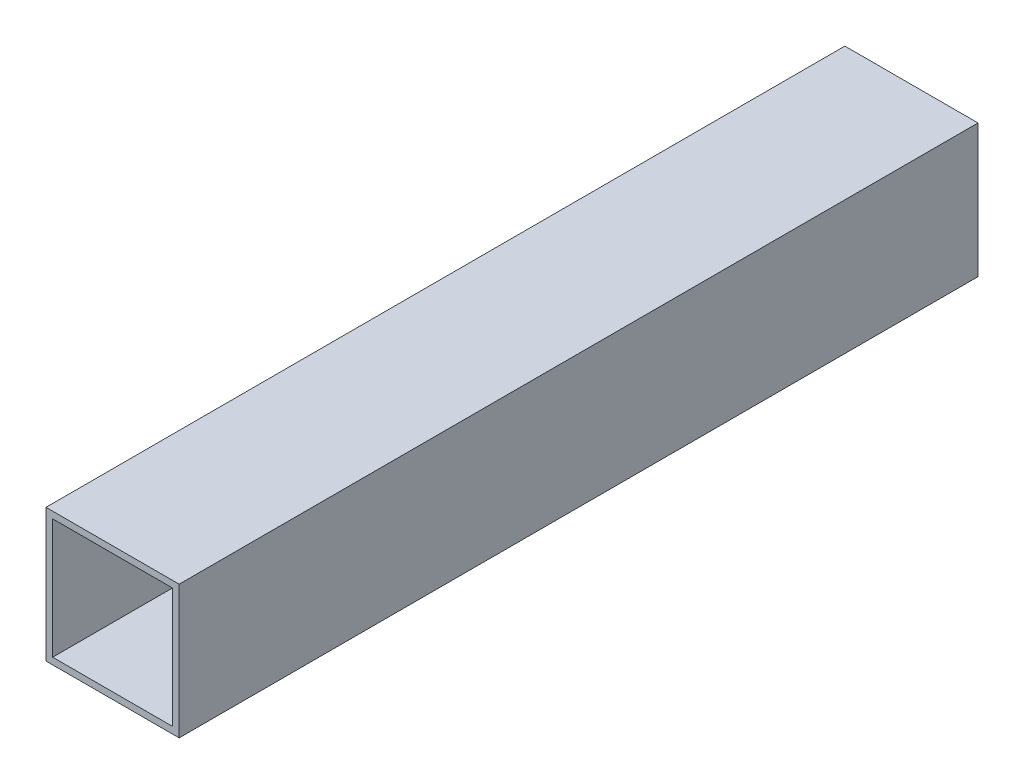
from build123d import *

# Parameters (mm, degrees)
SKETCH_1_W      = 10
SKETCH_1_H      = 10
SKETCH_1_W_2    = 9
SKETCH_1_H_2    = 9
EXTRUDE_1_DEPTH = 60


with BuildPart() as part:
    # 草图1 → 凸台-拉伸1 (new body)
    with BuildSketch(Plane.XY):
        with Locations((5, 5)):
            Rectangle(SKETCH_1_W, SKETCH_1_H)
        with Locations((5, 5)):
            Rectangle(SKETCH_1_W_2, SKETCH_1_H_2, mode=Mode.SUBTRACT)
    extrude(amount=EXTRUDE_1_DEPTH)


solid = part.part
